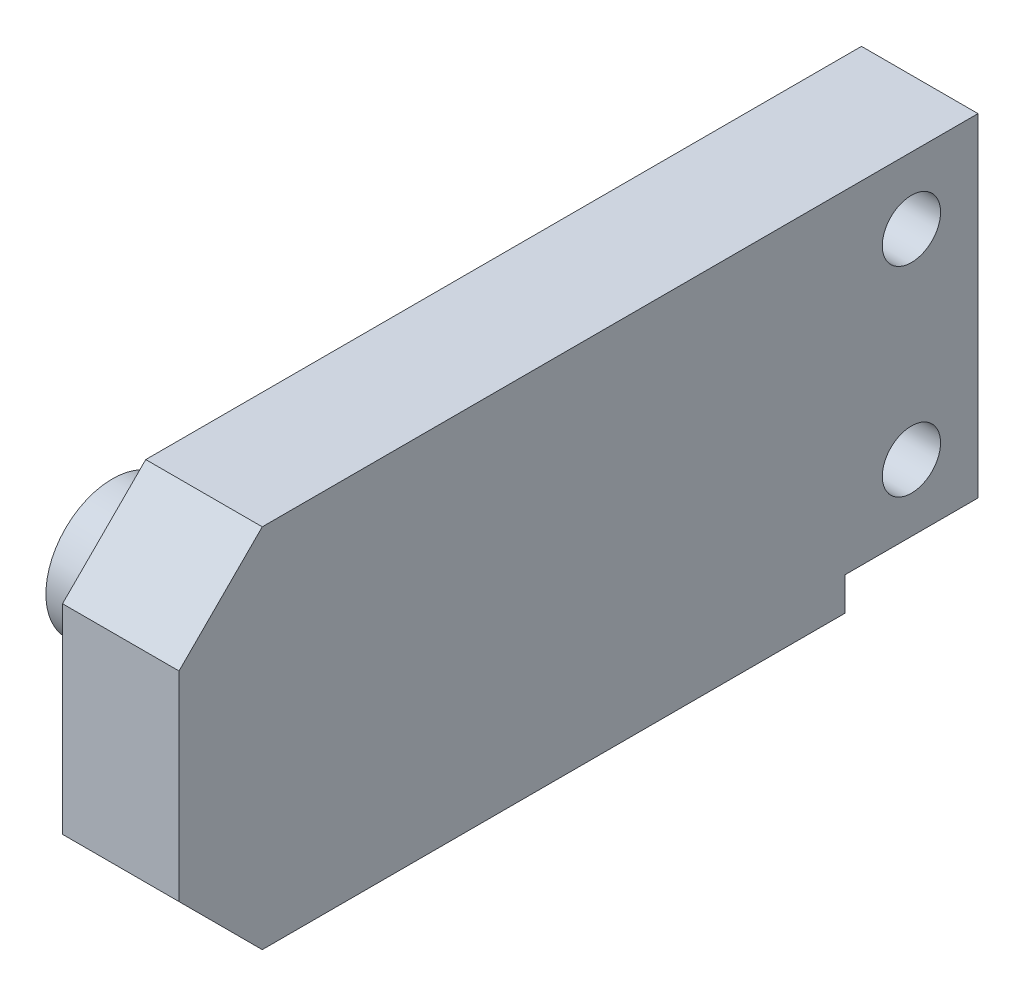
from build123d import *

# Parameters (mm, degrees)
SKETCH1_R               = 1.75
BOSS_EXTRUDE1_DEPTH     = 7
SKETCH1_4_R             = 4
BOSS_EXTRUDE2_DEPTH     = 7
CUT_EXTRUDE1_DEPTH      = 92.744209627
CUT_EXTRUDE1_DEPTH_BACK = 92.744209627
SKETCH2_W               = 104
SKETCH2_H               = 76.59410066


with BuildPart() as part:
    # Sketch1 → Boss-Extrude1 (new body)
    with BuildSketch(Plane(origin=(0, 0, 0), x_dir=(0, 0, -1), z_dir=(1, 0, 0))):
        Polygon((90, 11), (-5, 11), (-10, 6), (-10, -6), (-5, -11), (30, -11), (30, -9), (90, -9), align=None)
        with Locations((34, -5)):
            Circle(SKETCH1_R, mode=Mode.SUBTRACT)
        with BuildLine():
            ThreePointArc((64, -6.75), (62.25, -5), (64, -3.25))
            Line((64, -3.25), (66, -3.25))
            ThreePointArc((66, -3.25), (67.75, -5), (66, -6.75))
            Line((66, -6.75), (64, -6.75))
        make_face(mode=Mode.SUBTRACT)
        with Locations((34, 7)):
            Circle(SKETCH1_R, mode=Mode.SUBTRACT)
        with BuildLine():
            ThreePointArc((45, 3.25), (43.25, 5), (45, 6.75))
            Line((45, 6.75), (47, 6.75))
            ThreePointArc((47, 6.75), (48.75, 5), (47, 3.25))
            Line((47, 3.25), (45, 3.25))
        make_face(mode=Mode.SUBTRACT)
        with BuildLine():
            ThreePointArc((85, 6.75), (86.75, 5), (85, 3.25))
            Line((85, 3.25), (83, 3.25))
            ThreePointArc((83, 3.25), (81.25, 5), (83, 6.75))
            Line((83, 6.75), (85, 6.75))
        make_face(mode=Mode.SUBTRACT)
    extrude(amount=BOSS_EXTRUDE1_DEPTH)

    # Sketch1<4> → Boss-Extrude2 (add)
    with BuildSketch(Plane(origin=(0, 0, 0), x_dir=(0, 0, -1), z_dir=(1, 0, 0))):
        Circle(SKETCH1_4_R)
    extrude(amount=-BOSS_EXTRUDE2_DEPTH)

    # Sketch2 → Cut-Extrude1 (cut, two sides: drawn at the far end of the back side and taken through both)
    with BuildSketch(Plane(origin=(7, 0, 0), x_dir=(0, 0, -1), z_dir=(1, 0, 0)).offset(-CUT_EXTRUDE1_DEPTH_BACK)):
        with Locations((90, -9)):
            Rectangle(SKETCH2_W, SKETCH2_H)
    extrude(amount=CUT_EXTRUDE1_DEPTH + CUT_EXTRUDE1_DEPTH_BACK, mode=Mode.SUBTRACT)


solid = part.part
